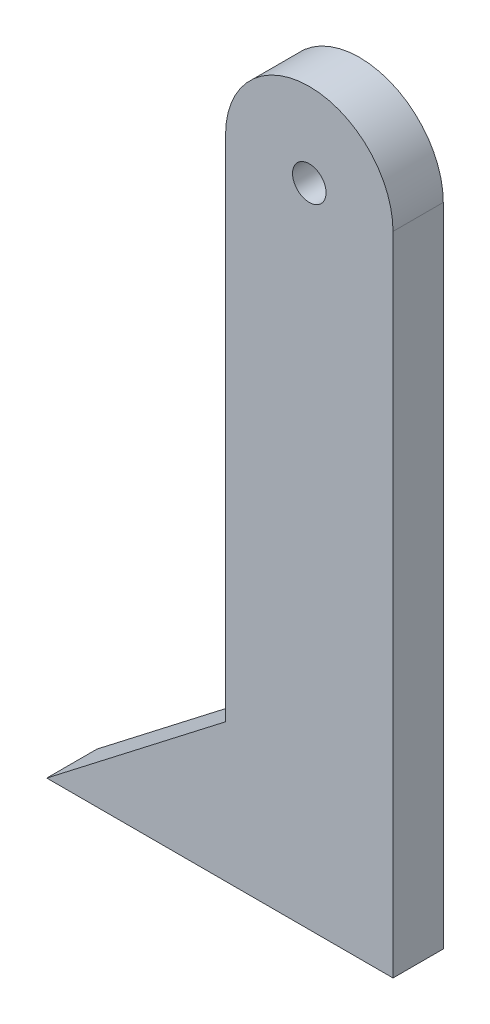
from build123d import *

# Parameters (mm, degrees)
SKETCH_1_R      = 1
EXTRUDE_1_DEPTH = 3
EXTRUDE_2_DEPTH = 3


with BuildPart() as part:
    # 草图1 → 凸台-拉伸1 (new body)
    with BuildSketch(Plane.XY):
        with BuildLine():
            Line((-5, 0), (-5, -30.357146931))
            Line((-5, -30.357146931), (5, -30.357146931))
            Line((5, -30.357146931), (5, 0))
            ThreePointArc((5, 0), (0, 5), (-5, 0))
        make_face()
        Circle(SKETCH_1_R, mode=Mode.SUBTRACT)
    extrude(amount=EXTRUDE_1_DEPTH)

    # 草图2 → 凸台-拉伸2 (add)
    with BuildSketch(Plane.XY.offset(3)):
        Polygon((-15.678069464, -38.606948739), (5, -38.606948739), (5, -35.668972407), (5, -30.357146931), (-5, -30.357146931), align=None)
    extrude(amount=-EXTRUDE_2_DEPTH)


solid = part.part
